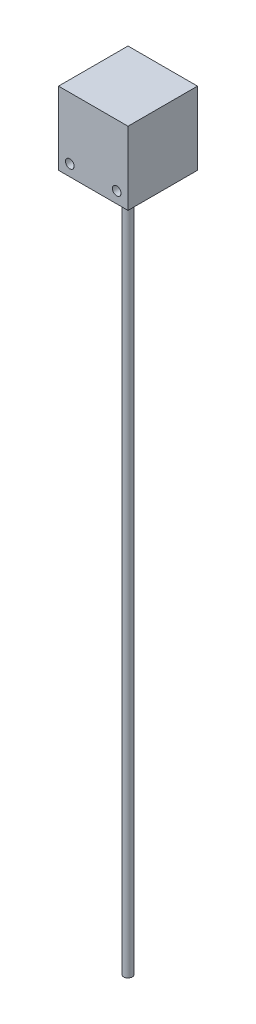
from build123d import *

# Parameters (mm, degrees)
EXTRUDE_1_DEPTH     = 20
SKETCH_1_3_W        = 2.5
SKETCH_1_3_H        = 401
SKETCH_2_R          = 2.5
CUT_EXTRUDE_1_DEPTH = 447.597133891


with BuildPart() as part:
    # 草图1 → 凸台-拉伸1 (new, symmetric)
    with BuildSketch(Plane.XY):
        Polygon((40, 0), (0, 0), (0, -42), (17.5, -42), (20, -42), (22.5, -42), (40, -42), align=None)
    extrude(amount=EXTRUDE_1_DEPTH, both=True)

    # 草图1<3> → 旋转1 (revolve)
    with BuildSketch(Plane.XY):
        with Locations((21.25, -242.5)):
            Rectangle(SKETCH_1_3_W, SKETCH_1_3_H)
    revolve(axis=Axis((20, -42, 0), (0, -1, 0)))

    # 草图2 → 切除-拉伸1 (cut, through all)
    with BuildSketch(Plane.XY.offset(20)):
        with Locations((6.5, -35.5)):
            Circle(SKETCH_2_R)
        with Locations((33.5, -35.5)):
            Circle(SKETCH_2_R)
    extrude(amount=-CUT_EXTRUDE_1_DEPTH, mode=Mode.SUBTRACT)


solid = part.part
